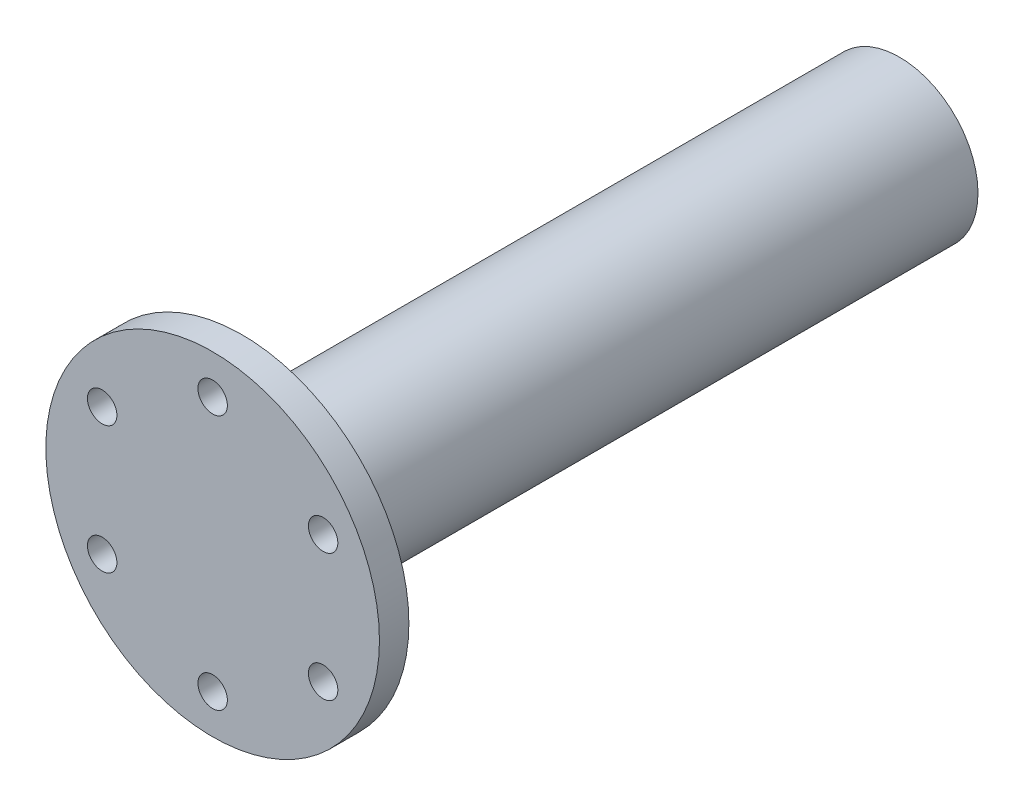
from build123d import *

# Parameters (mm, degrees)
CROQUIS1_R              = 8
SALIENTE_EXTRUIR1_DEPTH = 67
CROQUIS2_R              = 17
SALIENTE_EXTRUIR2_DEPTH = 3
CROQUIS3_R              = 9
SALIENTE_EXTRUIR3_DEPTH = 5
SALIENTE_EXTRUIR3_TAPER = 23
CROQUIS4_R              = 1.5
CORTAR_EXTRUIR2_DEPTH   = 5


with BuildPart() as part:
    # Croquis1 → Saliente-Extruir1 (new body)
    with BuildSketch(Plane.XY):
        Circle(CROQUIS1_R)
    extrude(amount=SALIENTE_EXTRUIR1_DEPTH)

    # Croquis2 → Saliente-Extruir2 (add)
    with BuildSketch(Plane.XY.offset(67)):
        Circle(CROQUIS2_R)
    extrude(amount=SALIENTE_EXTRUIR2_DEPTH)

    # Croquis3 → Saliente-Extruir3 (add)
    with BuildSketch(Plane(origin=(0, 0, 67), x_dir=(-1, 0, 0), z_dir=(0, 0, -1))):
        Circle(CROQUIS3_R)
    extrude(amount=SALIENTE_EXTRUIR3_DEPTH, taper=SALIENTE_EXTRUIR3_TAPER)

    # Croquis4 → Cortar-Extruir2 (cut)
    with BuildSketch(Plane.XY.offset(70)):
        with Locations((0, 13)):
            Circle(CROQUIS4_R)
        with Locations((11.258330249, 6.5)):
            Circle(CROQUIS4_R)
        with Locations((11.258330249, -6.5)):
            Circle(CROQUIS4_R)
        with Locations((0, -13)):
            Circle(CROQUIS4_R)
        with Locations((-11.258330249, -6.5)):
            Circle(CROQUIS4_R)
        with Locations((-11.258330249, 6.5)):
            Circle(CROQUIS4_R)
    extrude(amount=-CORTAR_EXTRUIR2_DEPTH, mode=Mode.SUBTRACT)


solid = part.part
